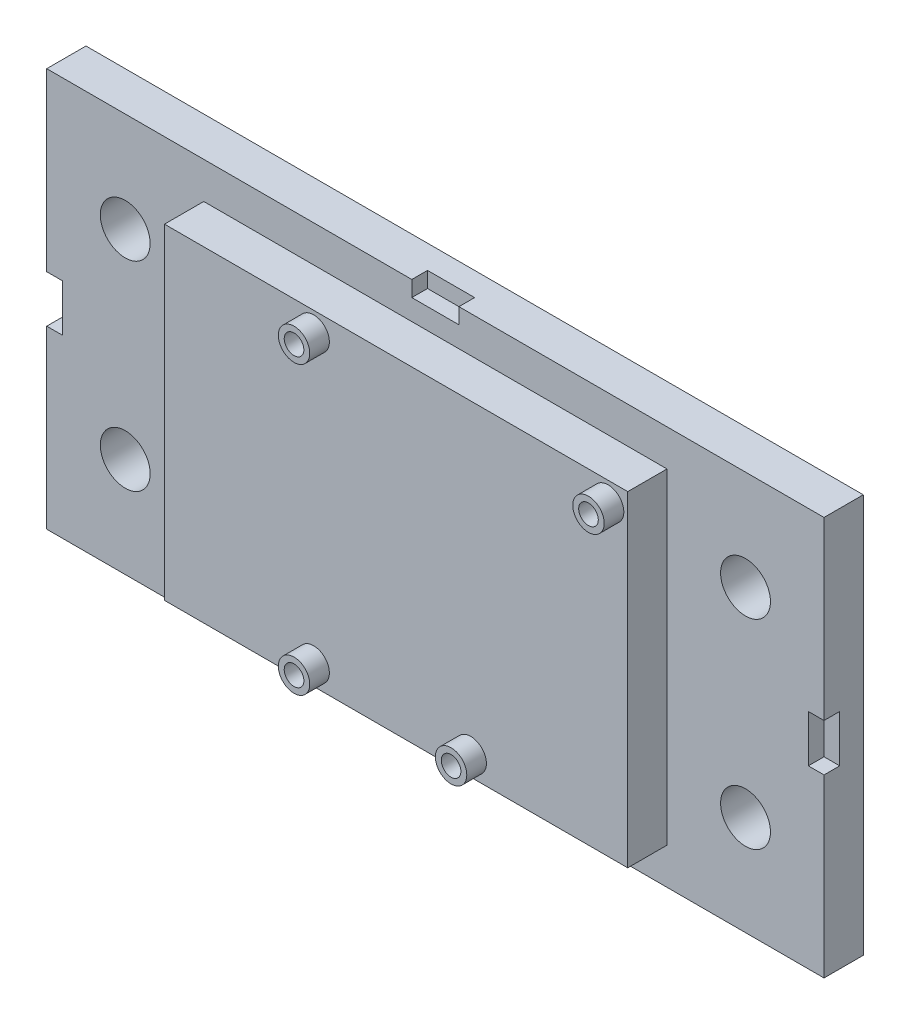
from build123d import *

# Parameters (mm, degrees)
SKETCH1_W           = 99
SKETCH1_H           = 50.8
BOSS_EXTRUDE1_DEPTH = 5
SKETCH3_W           = 59
SKETCH3_H           = 41.5
BOSS_EXTRUDE2_DEPTH = 5
SKETCH2_R           = 3.175
CUT_EXTRUDE1_DEPTH  = 56.860630143
SKETCH4_R           = 2
BOSS_EXTRUDE3_DEPTH = 2.5
SKETCH5_R           = 1.25
CUT_EXTRUDE2_DEPTH  = 12
SKETCH6_W           = 6
SKETCH6_H           = 2
CUT_EXTRUDE3_DEPTH  = 2
SKETCH7_W           = 2
SKETCH7_H           = 6
CUT_EXTRUDE4_DEPTH  = 2


with BuildPart() as part:
    # Sketch1 → Boss-Extrude1 (new body)
    with BuildSketch(Plane.XY):
        Rectangle(SKETCH1_W, SKETCH1_H)
    extrude(amount=BOSS_EXTRUDE1_DEPTH)

    # Sketch3 → Boss-Extrude2 (add)
    with BuildSketch(Plane.XY.offset(5)):
        Rectangle(SKETCH3_W, SKETCH3_H)
    extrude(amount=BOSS_EXTRUDE2_DEPTH)

    # Sketch2 → Cut-Extrude1 (cut, through all)
    with BuildSketch(Plane.XY.offset(5)):
        with Locations((-39.5, 12.7)):
            Circle(SKETCH2_R)
        with Locations((-39.5, -12.7)):
            Circle(SKETCH2_R)
        with Locations((39.5, -12.7)):
            Circle(SKETCH2_R)
        with Locations((39.5, 12.7)):
            Circle(SKETCH2_R)
    extrude(amount=-CUT_EXTRUDE1_DEPTH, mode=Mode.SUBTRACT)

    # Sketch4 → Boss-Extrude3 (add)
    with BuildSketch(Plane.XY.offset(10)):
        with Locations(Location((-10.5, -18.25, 0), (0, 0, 180))):
            Circle(SKETCH4_R)
        with Locations(Location((9.5, -18.25, 0), (0, 0, 180))):
            Circle(SKETCH4_R)
        with Locations(Location((-10.5, 18.25, 0), (0, 0, 180))):
            Circle(SKETCH4_R)
        with Locations(Location((27, 18.25, 0), (0, 0, 180))):
            Circle(SKETCH4_R)
    extrude(amount=BOSS_EXTRUDE3_DEPTH)

    # Sketch5 → Cut-Extrude2 (cut)
    with BuildSketch(Plane.XY.offset(12.5)):
        with Locations((-10.5, 18.25)):
            Circle(SKETCH5_R)
        with Locations((27, 18.25)):
            Circle(SKETCH5_R)
        with Locations((9.5, -18.25)):
            Circle(SKETCH5_R)
        with Locations((-10.5, -18.25)):
            Circle(SKETCH5_R)
    extrude(amount=-CUT_EXTRUDE2_DEPTH, mode=Mode.SUBTRACT)

    # Sketch6 → Cut-Extrude3 (cut)
    with BuildSketch(Plane(origin=(0, -25.4, 0), x_dir=(-1, 0, 0), z_dir=(0, -1, 0))):
        with Locations((0, -4)):
            Rectangle(SKETCH6_W, SKETCH6_H)
    cut_extrude3 = extrude(amount=-CUT_EXTRUDE3_DEPTH, mode=Mode.SUBTRACT)

    # Sketch7 → Cut-Extrude4 (cut)
    with BuildSketch(Plane.ZY.offset(49.5)):
        with Locations((4, 0)):
            Rectangle(SKETCH7_W, SKETCH7_H)
    cut_extrude4 = extrude(amount=-CUT_EXTRUDE4_DEPTH, mode=Mode.SUBTRACT)

    # Mirror1: Cut-Extrude3 across plane
    add(cut_extrude3.mirror(Plane.ZX), mode=Mode.SUBTRACT)

    # Mirror2: Cut-Extrude4 across plane
    add(cut_extrude4.mirror(Plane(origin=(0, 0, 0), x_dir=(0, 0, 1), z_dir=(1, 0, 0))), mode=Mode.SUBTRACT)


solid = part.part
